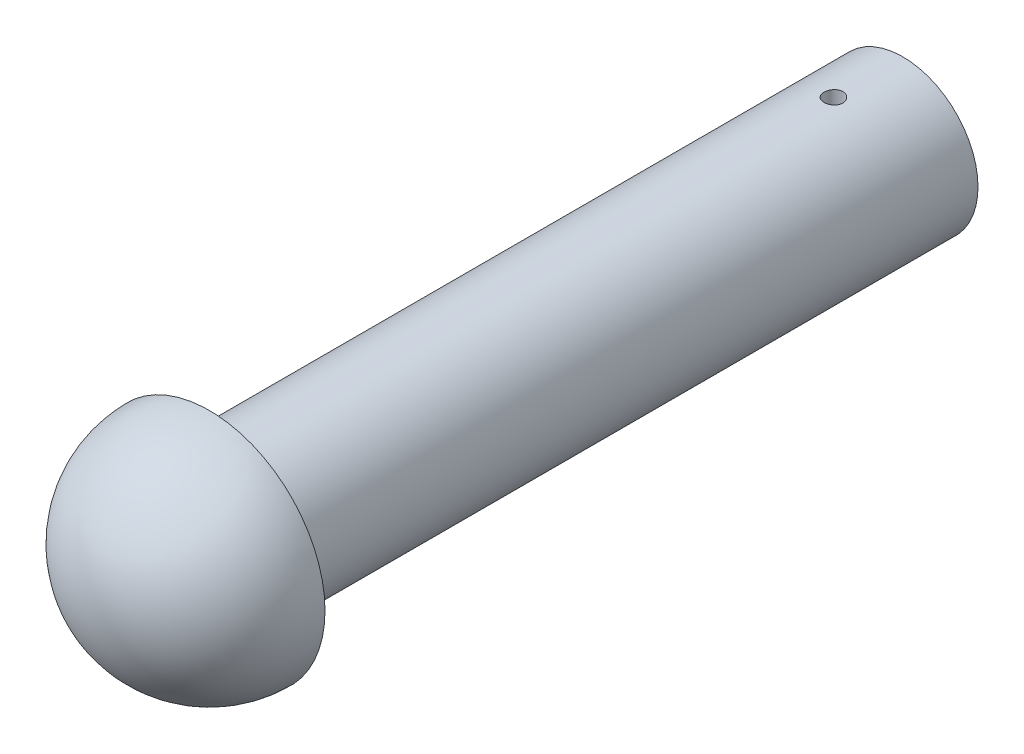
from build123d import *

# Parameters (mm, degrees)
SKETCH1_R               = 9.75
BOSS_EXTRUDE1_DEPTH     = 90
REVOLVE1_ANGLE          = 180
CUT_EXTRUDE1_DEPTH      = 22
CUT_EXTRUDE1_DEPTH_BACK = 22
SKETCH3_R               = 1.221236648


with BuildPart() as part:
    # Sketch1 → Boss-Extrude1 (new body)
    with BuildSketch(Plane.XY):
        Circle(SKETCH1_R)
    extrude(amount=BOSS_EXTRUDE1_DEPTH)

    # Sketch2 → Revolve1 (revolve)
    with BuildSketch(Plane.XY.offset(90)):
        with BuildLine():
            Line((0, 15), (0, -15))
            ThreePointArc((0, -15), (15, 0), (0, 15))
        make_face()
    revolve(axis=Axis((0, 15, 90), (0, -1, 0)), revolution_arc=REVOLVE1_ANGLE)

    # Sketch3 → Cut-Extrude1 (cut, two sides: drawn at the far end of the back side and taken through both)
    with BuildSketch(Plane(origin=(0, 0, 0), x_dir=(1, 0, 0), z_dir=(0, 1, 0)).offset(-CUT_EXTRUDE1_DEPTH_BACK)):
        with Locations((0.008150648, -9.023432345)):
            Circle(SKETCH3_R)
    extrude(amount=CUT_EXTRUDE1_DEPTH + CUT_EXTRUDE1_DEPTH_BACK, mode=Mode.SUBTRACT)


solid = part.part
